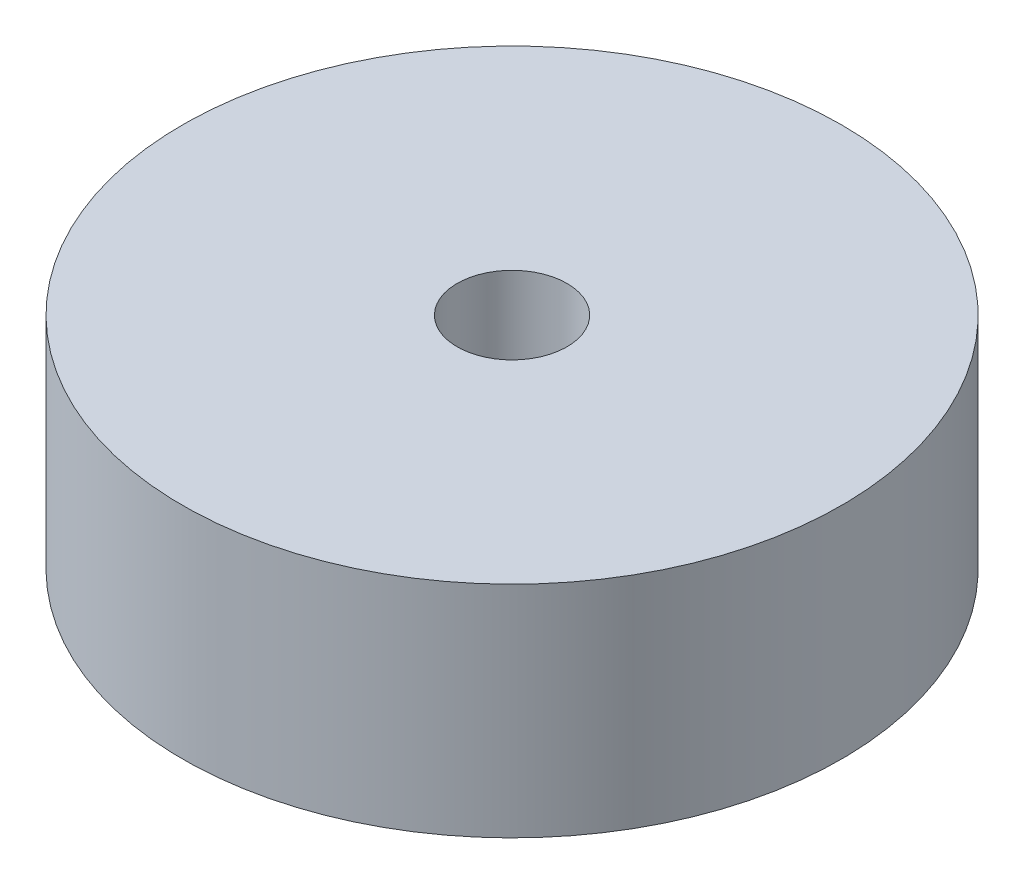
from build123d import *

# Parameters (mm, degrees)
SKETCH2_R           = 150
SKETCH2_R_2         = 25
BOSS_EXTRUDE1_DEPTH = 100


with BuildPart() as part:
    # Sketch2 → Boss-Extrude1 (new body)
    with BuildSketch(Plane(origin=(0, 0, 0), x_dir=(1, 0, 0), z_dir=(0, 1, 0))):
        with Locations(Location((0, 0, 0), (0, 0, 90))):
            Circle(SKETCH2_R)
        with Locations(Location((0, 0, 0), (0, 0, 90))):
            Circle(SKETCH2_R_2, mode=Mode.SUBTRACT)
    extrude(amount=BOSS_EXTRUDE1_DEPTH)


solid = part.part
